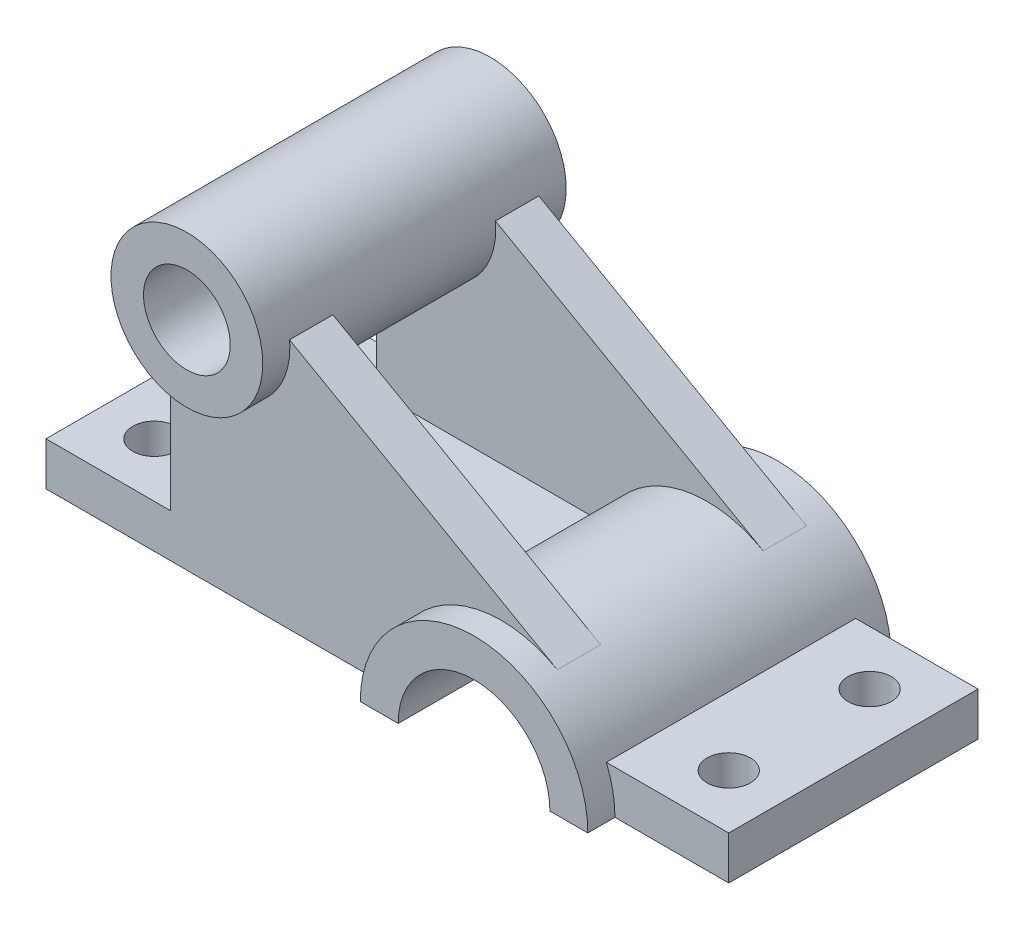
from build123d import *

# Parameters (mm, degrees)
BOSS_EXTRUDE1_DEPTH = 28
SKETCH2_R           = 14
SKETCH2_R_2         = 8
BOSS_EXTRUDE2_DEPTH = 28
BOSS_EXTRUDE4_DEPTH = 23
BOSS_EXTRUDE5_DEPTH = 8
HOLE1_D             = 8
HOLE2_D             = 8


with BuildPart() as part:
    # Sketch1 → Boss-Extrude1 (new, symmetric)
    with BuildSketch(Plane.XY):
        with BuildLine():
            Line((-21, 0), (-14, 0))
            ThreePointArc((-14, 0), (0, 14), (14, 0))
            Line((14, 0), (21, 0))
            ThreePointArc((21, 0), (0, 21), (-21, 0))
        make_face()
    extrude(amount=BOSS_EXTRUDE1_DEPTH, both=True)

    # Sketch6 → Boss-Extrude4 (add, symmetric)
    with BuildSketch(Plane.XY):
        with BuildLine():
            Line((-84, 0), (-14, 0))
            ThreePointArc((-14, 0), (-13.35754, 4.192389), (-11.489125, 8))
            Line((-11.489125, 8), (-84, 8))
            Line((-84, 8), (-84, 0))
        make_face()
        with BuildLine():
            Line((42, 0), (42, 8))
            Line((42, 8), (11.489125, 8))
            ThreePointArc((11.489125, 8), (13.35754, 4.192389), (14, 0))
            Line((14, 0), (42, 0))
        make_face()
    extrude(amount=BOSS_EXTRUDE4_DEPTH, both=True)



with BuildPart() as body_2:
    # Sketch2 → Boss-Extrude2 (new, symmetric)
    with BuildSketch(Plane.XY):
        with Locations((-53, 45)):
            Circle(SKETCH2_R)
        with Locations((-53, 45)):
            Circle(SKETCH2_R_2, mode=Mode.SUBTRACT)
    extrude(amount=BOSS_EXTRUDE2_DEPTH, both=True)


with BuildPart() as part_1:
    add(part.part)

    add(body_2.part)  # Boss-Extrude5 merges body 2
    # Sketch7 → Boss-Extrude5 (add)
    with BuildSketch(Plane.XY.offset(23)):
        with BuildLine():
            Line((-61, 45), (-61, 8))
            Line((-61, 8), (-19.416488, 8))
            ThreePointArc((-19.416488, 8), (-6.845704, 19.852867), (10.35897, 18.267231))
            Line((10.35897, 18.267231), (-49.053726, 51.958945))
            ThreePointArc((-49.053726, 51.958945), (-48.973227, 38.087323), (-61, 45))
        make_face()
    boss_extrude5 = extrude(amount=-BOSS_EXTRUDE5_DEPTH)

    # Mirror1: Boss-Extrude5 across plane
    add(boss_extrude5.mirror(Plane.XY))

    # Hole1 (through all)
    with Locations(Plane(origin=(0, 8, 0), x_dir=(1, 0, 0), z_dir=(0, 1, 0))):
        with Locations((32, 13), (32, -13)):
            Hole(HOLE1_D / 2)

    # Hole2 (through all)
    with Locations(Plane(origin=(0, 8, 0), x_dir=(1, 0, 0), z_dir=(0, 1, 0))):
        with Locations((-74, -13), (-74, 13)):
            Hole(HOLE2_D / 2)


solid = part_1.part
